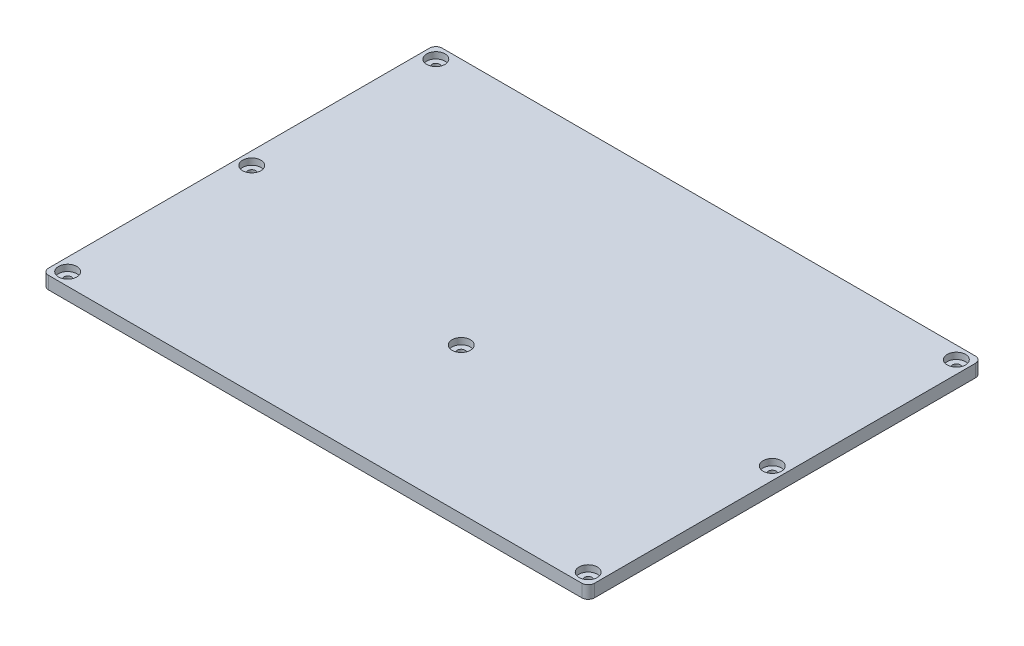
from build123d import *

# Parameters (mm, degrees)
SKETCH1_W             = 273.05
SKETCH1_H             = 196.85
BOSS_EXTRUDE1_DEPTH   = 6.35
F_6_CLEARANCE_HOLE1_D = 3.7973
SKETCH4_R             = 4.582717762
CUT_EXTRUDE1_DEPTH    = 3.175
FILLET1_R             = 3.175


with BuildPart() as part:
    # Sketch1 → Boss-Extrude1 (new body)
    with BuildSketch(Plane(origin=(0, 0, 0), x_dir=(1, 0, 0), z_dir=(0, 1, 0))):
        Rectangle(SKETCH1_W, SKETCH1_H)
    extrude(amount=BOSS_EXTRUDE1_DEPTH)

    # #6 Clearance Hole1 (through all)
    with Locations(Plane(origin=(0, 6.35, 0), x_dir=(1, 0, 0), z_dir=(0, 1, 0))):
        with Locations((-130.175, 92.075), (130.175, 92.075), (130.175, -92.075), (-130.175, -92.075), (-130.175, 0), (130.175, 0), (0, -25.4)):
            Hole(F_6_CLEARANCE_HOLE1_D / 2)

    # Sketch4 → Cut-Extrude1 (cut)
    with BuildSketch(Plane(origin=(0, 6.35, 0), x_dir=(1, 0, 0), z_dir=(0, 1, 0))):
        with Locations(Location((-130.175, 92.075, 0), (0, 0, 270))):
            Circle(SKETCH4_R)
        with Locations(Location((130.175, 92.075, 0), (0, 0, 270))):
            Circle(SKETCH4_R)
        with Locations(Location((130.175, -92.075, 0), (0, 0, 270))):
            Circle(SKETCH4_R)
        with Locations(Location((-130.175, -92.075, 0), (0, 0, 270))):
            Circle(SKETCH4_R)
        with Locations(Location((-130.175, 0, 0), (0, 0, 270))):
            Circle(SKETCH4_R)
        with Locations(Location((130.175, 0, 0), (0, 0, 270))):
            Circle(SKETCH4_R)
        with Locations(Location((0, -25.4, 0), (0, 0, 270))):
            Circle(SKETCH4_R)
    extrude(amount=-CUT_EXTRUDE1_DEPTH, mode=Mode.SUBTRACT)

    # Fillet1
    fillet1_edges = [part.edges().sort_by_distance(p)[0] for p in [
        (136.525, 3.175, 98.425),
        (-136.525, 3.175, 98.425),
        (-136.525, 3.175, -98.425),
        (136.525, 3.175, -98.425),
    ]]
    fillet(fillet1_edges, radius=FILLET1_R)


solid = part.part
